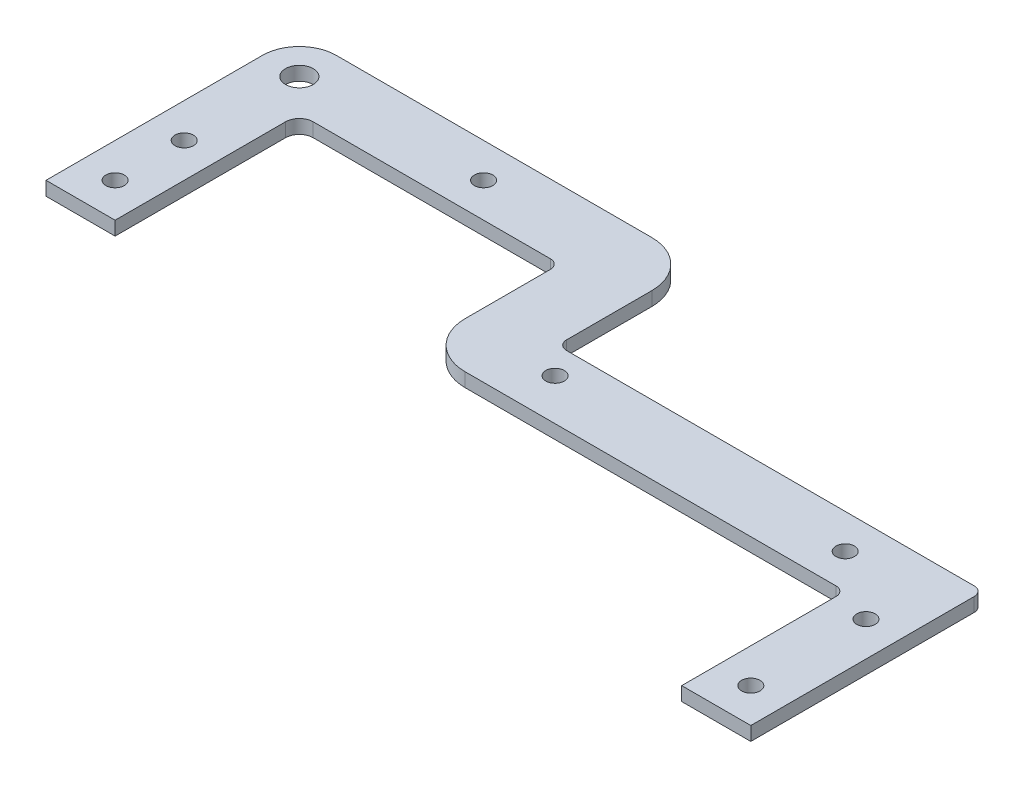
from build123d import *

# Parameters (mm, degrees)
EXTRUDE_1_DEPTH     = 3
SKETCH_2_R          = 2
SKETCH_2_R_2        = 3
CUT_EXTRUDE_1_DEPTH = 10
FILLET_1_R          = 10
FILLET_2_R          = 2
FILLET_3_R          = 3


with BuildPart() as part:
    # 草图1 → 凸台-拉伸1 (new body)
    with BuildSketch(Plane(origin=(0, 0, 0), x_dir=(1, 0, 0), z_dir=(0, 1, 0))):
        with BuildLine():
            Line((-55, 0), (-40, 0))
            Line((-40, 0), (-40, 50.5))
            Line((-40, 50.5), (-132.5, 50.5))
            Line((-132.5, 50.5), (-132.5, 81))
            Line((-132.5, 81), (-211, 81))
            ThreePointArc((-211, 81), (-216.656854249, 78.656854249), (-219, 73))
            Line((-219, 73), (-219, 26))
            Line((-219, 26), (-204, 26))
            Line((-204, 26), (-204, 66))
            Line((-204, 66), (-147.5, 66))
            Line((-147.5, 66), (-147.5, 35.5))
            Line((-147.5, 35.5), (-55, 35.5))
            Line((-55, 35.5), (-55, 0))
        make_face()
    extrude(amount=EXTRUDE_1_DEPTH)

    # 草图2 → 切除-拉伸1 (cut)
    with BuildSketch(Plane(origin=(0, 3, 0), x_dir=(1, 0, 0), z_dir=(0, 1, 0))):
        with Locations(Location((-47.5, 32.5, 0), (0, 0, 270))):
            Circle(SKETCH_2_R)
        with Locations(Location((-211.5, 33.5, 0), (0, 0, 270))):
            Circle(SKETCH_2_R)
        with Locations(Location((-211.5, 48.5, 0), (0, 0, 270))):
            Circle(SKETCH_2_R)
        with Locations(Location((-211, 73, 0), (0, 0, 270))):
            Circle(SKETCH_2_R_2)
        with Locations(Location((-171.5, 73.5, 0), (0, 0, 270))):
            Circle(SKETCH_2_R)
        with Locations(Location((-127, 44.5, 0), (0, 0, 270))):
            Circle(SKETCH_2_R)
        with Locations(Location((-62.5, 43, 0), (0, 0, 270))):
            Circle(SKETCH_2_R)
        with Locations(Location((-47.5, 7.5, 0), (0, 0, 270))):
            Circle(SKETCH_2_R)
    extrude(amount=-CUT_EXTRUDE_1_DEPTH, mode=Mode.SUBTRACT)

    # 圆角1
    fillet_1_edges = [part.edges().sort_by_distance(p)[0] for p in [
        (-147.5, 1.5, -35.5),
        (-132.5, 1.5, -81),
    ]]
    fillet(fillet_1_edges, radius=FILLET_1_R)

    # 圆角2
    fillet_2_edges = [part.edges().sort_by_distance(p)[0] for p in [
        (-40, 1.5, -50.5),
        (-55, 1.5, -35.5),
        (-147.5, 1.5, -66),
        (-132.5, 1.5, -50.5),
    ]]
    fillet(fillet_2_edges, radius=FILLET_2_R)

    # 圆角3
    fillet_3_edges = [part.edges().sort_by_distance(p)[0] for p in [
        (-204, 1.5, -66),
    ]]
    fillet(fillet_3_edges, radius=FILLET_3_R)


solid = part.part
